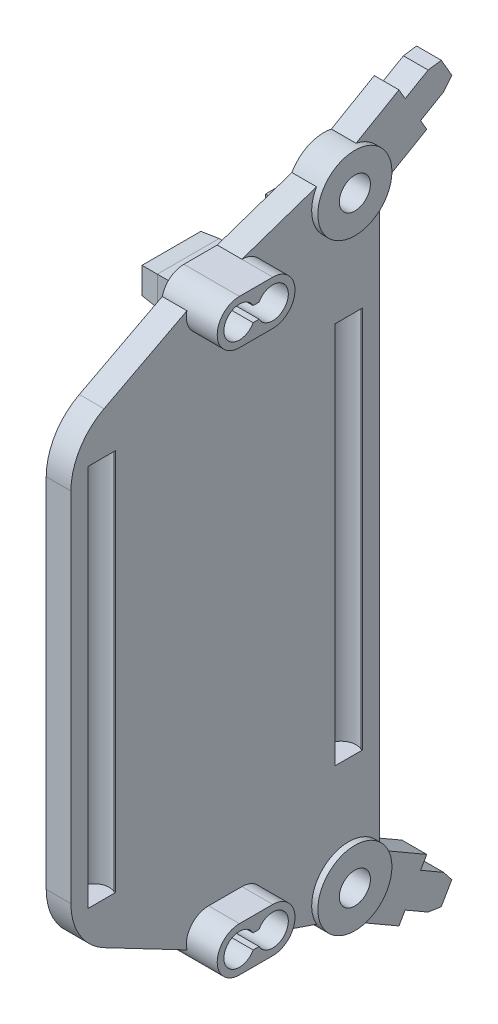
from build123d import *

# Parameters (mm, degrees)
DOWELSUPPORT_DEPTH          = 1.905
DOWELSUPPORT_DEPTH_BACK     = 1.27
SKETCH3_R                   = 3.81
SKETCH5_W                   = 6.35
SKETCH5_H                   = 44.45
SLIDERDOWELSUPPORT_DEPTH    = 1.27
SKETCH17_R                  = 1.549999948
CUT_EXTRUDE1_DEPTH          = 19.685
CUT_EXTRUDE2_DEPTH          = 36.118212712
CUT_EXTRUDE2_DEPTH_BACK     = 36.118212712
SKETCH18_W                  = 1.27
SKETCH18_H                  = 25.4
LPATTERN1_COUNT             = 2
LPATTERN1_PITCH             = 25.4
LATERALSUPPORT_DEPTH        = 1.27
SKETCH8_W                   = 6.35
SKETCH8_H                   = 3
TABSUPPORT_DEPTH            = 1.27
STRINGDOWELSUPPORT_START    = -1.27
STRINGDOWELSUPPORT_DEPTH    = 5.715
INTERSUPPORT_DEPTH          = 1.27
SKETCH10_W                  = 6.35
SKETCH10_H                  = 3
TABBASE_DEPTH               = 1.27
SKETCH12_W                  = 6.35
SKETCH12_H                  = 3
TABDRAFT_DEPTH              = 1.73
TABDRAFT_DRAFT              = 5
TABDRAFT_PROFILE_2_DEPTH    = 1.73
TABDRAFT_PROFILE_2_DRAFT    = 5
STRINGDOWELHOLES_DEPTH      = 48.707819409
STRINGDOWELHOLES_DEPTH_BACK = 1.524
SKETCH14_R                  = 1.600000102
PULLEYDOWELHOLE_DEPTH       = 2.921
FILLET1_R                   = 6.35


with BuildPart() as part:
    # Sketch3 → DowelSupport (new, two sides: drawn at the far end of the back side and taken through both)
    with BuildSketch(Plane(origin=(0, 0, 0), x_dir=(0, 0, -1), z_dir=(1, 0, 0)).offset(-DOWELSUPPORT_DEPTH_BACK)):
        with Locations((0, 30.95625)):
            Circle(SKETCH3_R)
    extrude(amount=DOWELSUPPORT_DEPTH + DOWELSUPPORT_DEPTH_BACK)

    # Sketch8 → TabSupport (add, symmetric)
    with BuildSketch(Plane(origin=(0, 0, 0), x_dir=(0, 0, -1), z_dir=(1, 0, 0))):
        with Locations((0, 27.94)):
            Rectangle(SKETCH8_W, SKETCH8_H)
        with Locations((-12.7, 27.94)):
            Rectangle(SKETCH8_W, SKETCH8_H)
    extrude(amount=TABSUPPORT_DEPTH, both=True)


with BuildPart() as body_2:
    # Sketch5 → SliderDowelSupport (new, symmetric)
    with BuildSketch(Plane(origin=(0, 0, 0), x_dir=(0, 0, -1), z_dir=(1, 0, 0))):
        Rectangle(SKETCH5_W, SKETCH5_H)
    extrude(amount=SLIDERDOWELSUPPORT_DEPTH, both=True)

    # Sketch17 → Cut-Extrude1 (cut, symmetric)
    with BuildSketch(Plane(origin=(0, 0, 0), x_dir=(1, 0, 0), z_dir=(0, 1, 0))):
        with Locations((0.482000052, 0)):
            Circle(SKETCH17_R)
        with BuildLine():
            Line((2.032, 0), (2.032, 1.399999994))
            Line((2.032, 1.399999994), (1.147206678, 1.399999994))
            ThreePointArc((1.147206678, 1.399999994), (1.792261491, 0.828078983), (2.032, 0))
        make_face()
        with BuildLine():
            Line((2.032, -1.399999994), (2.032, 0))
            ThreePointArc((2.032, 0), (1.792261491, -0.828078983), (1.147206678, -1.399999994))
            Line((1.147206678, -1.399999994), (2.032, -1.399999994))
        make_face()
    extrude(amount=CUT_EXTRUDE1_DEPTH, both=True, mode=Mode.SUBTRACT)

    # Sketch18 → Cut-Extrude2 (cut, two sides: drawn at the far end of the back side and taken through both)
    with BuildSketch(Plane.ZY.offset(1.27).offset(-CUT_EXTRUDE2_DEPTH_BACK)):
        Rectangle(SKETCH18_W, SKETCH18_H)
    extrude(amount=CUT_EXTRUDE2_DEPTH + CUT_EXTRUDE2_DEPTH_BACK, mode=Mode.SUBTRACT)


with BuildPart() as lpattern1_1:
    # LPattern1: pattern copy
    add(body_2.part.moved(Location(Vector(0, 0, 1) * (1 * LPATTERN1_PITCH))))


with BuildPart() as body_4:
    # Sketch6 → LateralSupport (new, symmetric)
    with BuildSketch(Plane(origin=(0, 0, 0), x_dir=(0, 0, -1), z_dir=(1, 0, 0))):
        Polygon((7.392863577, 33.391434671), (5.805363577, 36.141065329), (8.169612929, 37.506065329), (9.523465192, 37.701124423), (10.602965192, 35.831375577), (9.757112929, 34.756434671), align=None)
    extrude(amount=LATERALSUPPORT_DEPTH, both=True)


with BuildPart() as tabsupport_piece_1:
    # of the separate pieces the step leaves, piece 1, a body of its own (tabsupport_pieces)
    add(part.part.solids().sort_by_distance((0, 30.95625, -3.81))[0])


with BuildPart() as tabsupport_piece_2:
    # of the separate pieces the step leaves, piece 2, a body of its own (tabsupport_pieces)
    add(part.part.solids().sort_by_distance((-1.27, 26.44, 9.525))[0])

    # Sketch15 → StringDowelSupport (add)
    with BuildSketch(Plane(origin=(0, 0, 0), x_dir=(0, 0, -1), z_dir=(1, 0, 0)).offset(STRINGDOWELSUPPORT_START)):
        with BuildLine():
            Line((-14.4145, 30.226), (-10.9855, 30.226))
            ThreePointArc((-10.9855, 30.226), (-8.6995, 27.94), (-10.9855, 25.654))
            Line((-10.9855, 25.654), (-14.4145, 25.654))
            ThreePointArc((-14.4145, 25.654), (-16.7005, 27.94), (-14.4145, 30.226))
        make_face()
    extrude(amount=STRINGDOWELSUPPORT_DEPTH)


with BuildPart() as body_2_1:
    add(body_2.part)

    add(lpattern1_1.part)  # InterSupport merges LPattern1_1

    add(body_4.part)  # InterSupport merges body 4

    add(tabsupport_piece_1.part)  # InterSupport merges TabSupport piece 1

    add(tabsupport_piece_2.part)  # InterSupport merges TabSupport piece 2
    # Sketch7 → InterSupport (add, symmetric)
    with BuildSketch(Plane(origin=(0, 0, 0), x_dir=(0, 0, -1), z_dir=(1, 0, 0))):
        Polygon((5.170363577, 37.240917591), (8.027863577, 32.291582409), (1.42875, 28.481582409), (-1.42875, 33.430917591), align=None)
        Polygon((-3.175, 15.875), (-3.175, 22.225), (3.175, 22.225), (3.175, 26.44), (0.923046602, 28.251940251), (-0.923046602, 33.660559749), (-10.9855, 30.226), (-14.4145, 30.226), (-15.109807039, 29.269115541), (-28.575, 22.225), (-22.225, 22.225), (-22.225, 0), (-3.175, 0), align=None)
    extrude(amount=INTERSUPPORT_DEPTH, both=True)

    # Sketch10 → TabBase (add)
    with BuildSketch(Plane.ZY.offset(1.27)):
        with Locations((0, 27.94)):
            Rectangle(SKETCH10_W, SKETCH10_H)
        with Locations((12.7, 27.94)):
            Rectangle(SKETCH10_W, SKETCH10_H)
    extrude(amount=TABBASE_DEPTH)


with BuildPart() as tabdraft_tool:
    # Sketch12 → TabDraft (with draft: the straight prism first)
    with BuildSketch(Plane.ZY.offset(2.54)):
        with Locations((0, 27.94)):
            Rectangle(SKETCH12_W, SKETCH12_H)
    extrude(amount=TABDRAFT_DEPTH)
    # TabDraft: the draft: its side faces are tilted about the plane it starts from
    tabdraft_sides = [tabdraft_tool.faces().sort_by_distance(p)[0] for p in [
        (-3.405, 27.94, 3.175),
        (-3.405, 29.44, 0),
        (-3.405, 27.94, -3.175),
        (-3.405, 26.44, 0),
    ]]
    draft(tabdraft_sides, Plane.ZY.offset(2.54), TABDRAFT_DRAFT)


with BuildPart() as body_2_2:
    add(body_2_1.part)

    # TabDraft: add tabdraft_tool
    add(tabdraft_tool.part)


with BuildPart() as tabdraft_profile_2_tool:
    # Sketch12 → TabDraft profile 2 (with draft: the straight prism first)
    with BuildSketch(Plane.ZY.offset(2.54)):
        with Locations((12.7, 27.94)):
            Rectangle(SKETCH12_W, SKETCH12_H)
    extrude(amount=TABDRAFT_PROFILE_2_DEPTH)
    # TabDraft profile 2: the draft: its side faces are tilted about the plane it starts from
    tabdraft_profile_2_sides = [tabdraft_profile_2_tool.faces().sort_by_distance(p)[0] for p in [
        (-3.405, 27.94, 9.525),
        (-3.405, 26.44, 12.7),
        (-3.405, 27.94, 15.875),
        (-3.405, 29.44, 12.7),
    ]]
    draft(tabdraft_profile_2_sides, Plane.ZY.offset(2.54), TABDRAFT_PROFILE_2_DRAFT)


with BuildPart() as body_2_3:
    add(body_2_2.part)

    # TabDraft profile 2: add tabdraft_profile_2_tool
    add(tabdraft_profile_2_tool.part)

    # Sketch16 → StringDowelHoles (cut, two sides: drawn at the far end of the back side and taken through both)
    with BuildSketch(Plane(origin=(1.905, 0, 0), x_dir=(0, 0, -1), z_dir=(1, 0, 0)).offset(-STRINGDOWELHOLES_DEPTH_BACK)):
        with BuildLine():
            Line((-13.00760401, 27.178), (-12.39239599, 27.178))
            ThreePointArc((-12.39239599, 27.178), (-9.385499898, 27.94), (-12.39239599, 28.702))
            Line((-12.39239599, 28.702), (-13.00760401, 28.702))
            ThreePointArc((-13.00760401, 28.702), (-16.014500102, 27.94), (-13.00760401, 27.178))
        make_face()
    extrude(amount=STRINGDOWELHOLES_DEPTH + STRINGDOWELHOLES_DEPTH_BACK, mode=Mode.SUBTRACT)

    # Sketch14 → PulleyDowelHole (cut)
    with BuildSketch(Plane(origin=(1.905, 0, 0), x_dir=(0, 0, -1), z_dir=(1, 0, 0))):
        with Locations((0, 30.95625)):
            Circle(SKETCH14_R)
    extrude(amount=-PULLEYDOWELHOLE_DEPTH, mode=Mode.SUBTRACT)

    # Mirror1: body 2 across plane


with BuildPart() as body_2_4:
    add(body_2_3.part)
    add(body_2_3.part.mirror(Plane.ZX))

    # Fillet1
    fillet1_edges = [body_2_4.edges().sort_by_distance(p)[0] for p in [
        (0, -22.225, 28.575),
        (0, 22.225, 28.575),
    ]]
    fillet(fillet1_edges, radius=FILLET1_R)


solid = body_2_4.part
